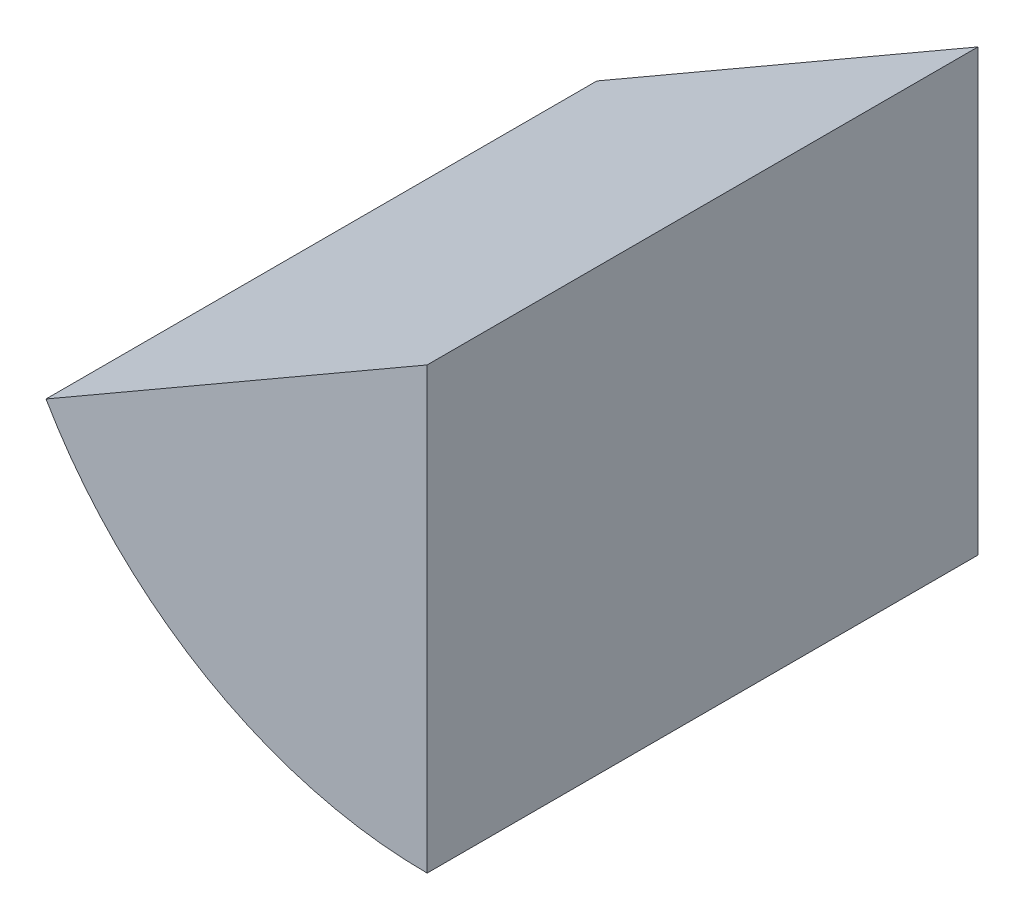
from build123d import *

# Parameters (mm, degrees)
SALIENTE_EXTRUIR1_DEPTH = 50
CROQUIS2_R              = 5.021904159
CORTAR_EXTRUIR1_DEPTH   = 10


with BuildPart() as part:
    # Croquis1 → Saliente-Extruir1 (new body)
    with BuildSketch(Plane.XY):
        with BuildLine():
            Line((0, 0), (0, -39.94640218))
            ThreePointArc((0, -39.94640218), (-19.97320109, -34.594599078), (-34.594599078, -19.97320109))
            Line((-34.594599078, -19.97320109), (0, 0))
        make_face()
    extrude(amount=SALIENTE_EXTRUIR1_DEPTH)

    # Croquis2 → Cortar-Extruir1 (cut)
    with BuildSketch(Plane(origin=(0, 0, 0), x_dir=(-1, 0, 0), z_dir=(0, 0, -1))):
        with Locations((12.191490543, -22.131013225)):
            Circle(CROQUIS2_R)
    extrude(amount=-CORTAR_EXTRUIR1_DEPTH, mode=Mode.SUBTRACT)


solid = part.part
